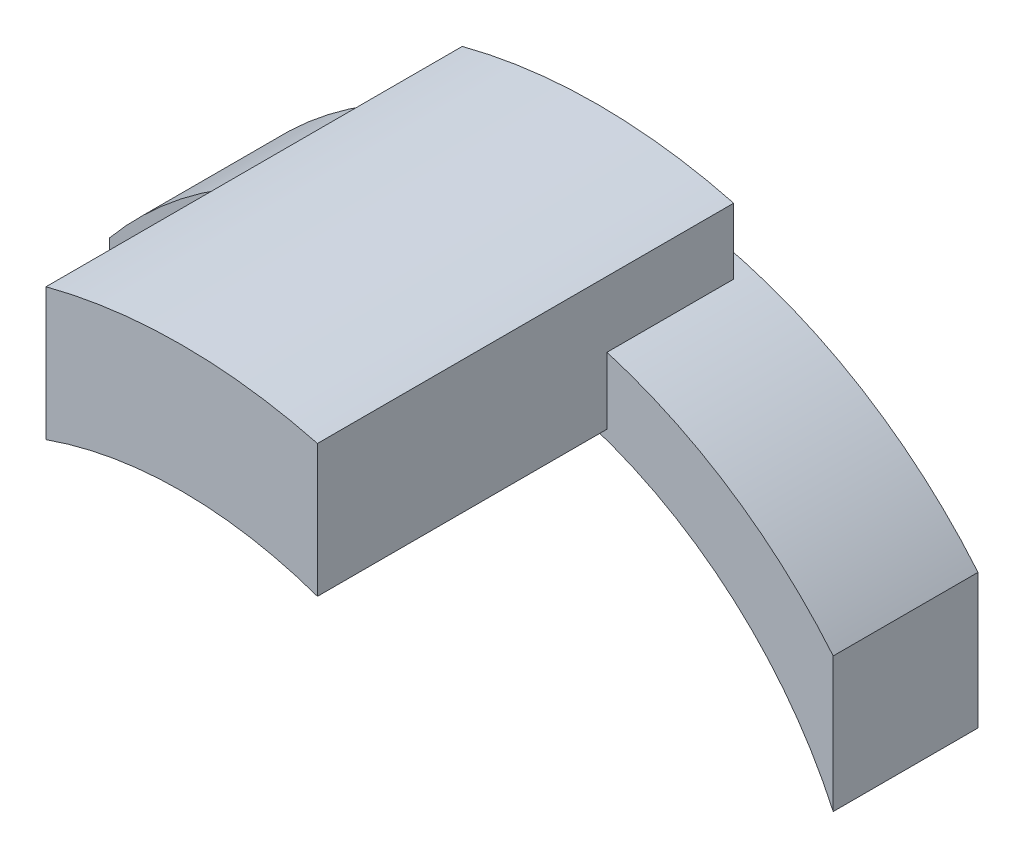
from build123d import *

# Parameters (mm, degrees)
EXTRUDE1_DEPTH      = 4
EXTRUDE2_DEPTH      = 7
EXTRUDE2_DEPTH_BACK = 16


with BuildPart() as part:
    # Sketch1 → Extrude1 (new, symmetric)
    with BuildSketch(Plane.XY):
        with BuildLine():
            Line((-20, 9.16515139), (-20, 16.613247726))
            ThreePointArc((-20, 16.613247726), (0, 26), (20, 16.613247726))
            Line((20, 16.613247726), (20, 9.16515139))
            ThreePointArc((20, 9.16515139), (0, 22), (-20, 9.16515139))
        make_face()
    extrude(amount=EXTRUDE1_DEPTH, both=True)

    # Sketch2 → Extrude2 (add, two sides: drawn at the far end of the back side and taken through both)
    with BuildSketch(Plane(origin=(0, 0, 4), x_dir=(-1, 0, 0), z_dir=(0, 0, -1)).offset(-EXTRUDE2_DEPTH_BACK)):
        with BuildLine():
            Line((7.5, 21.213203436), (7.5, 28.530685235))
            ThreePointArc((7.5, 28.530685235), (0, 29.5), (-7.5, 28.530685235))
            Line((-7.5, 28.530685235), (-7.5, 21.213203436))
            ThreePointArc((-7.5, 21.213203436), (0, 22.5), (7.5, 21.213203436))
        make_face()
    extrude(amount=EXTRUDE2_DEPTH + EXTRUDE2_DEPTH_BACK)


solid = part.part
